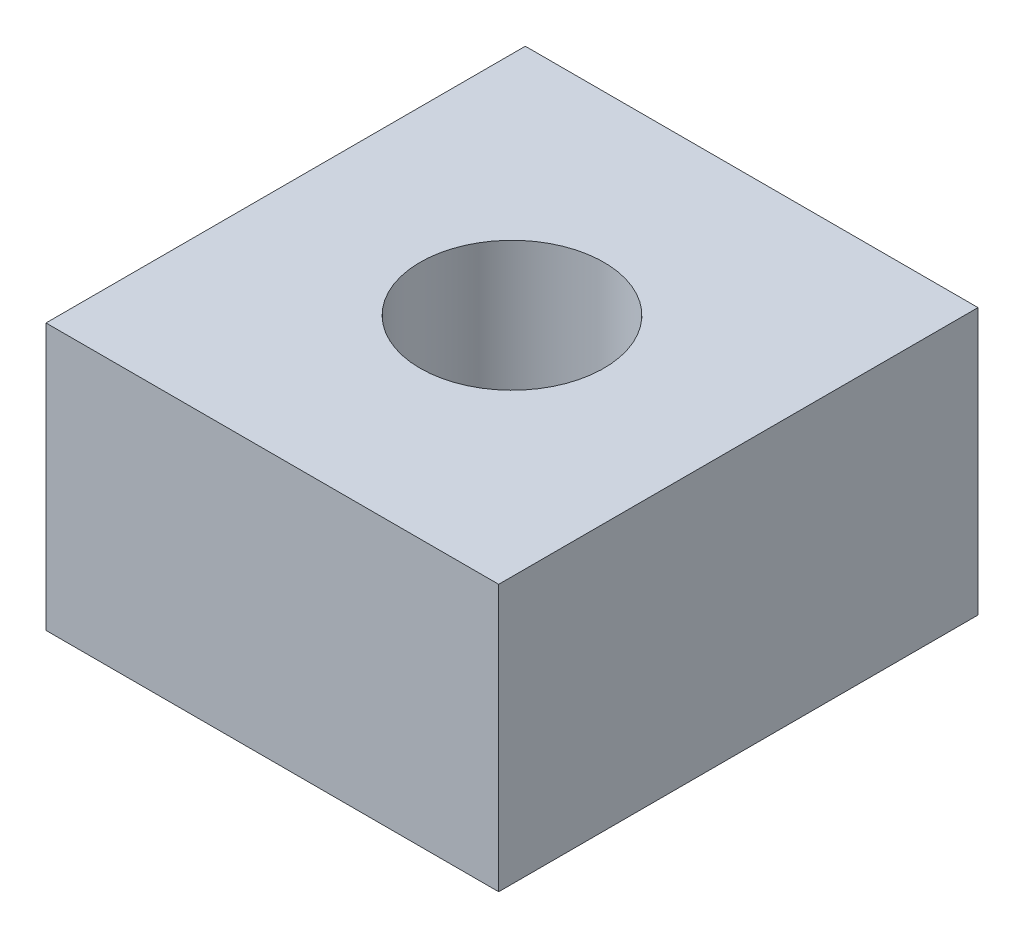
from build123d import *

# Parameters (mm, degrees)
SKETCH1_W           = 17
SKETCH1_H           = 18
BOSS_EXTRUDE1_DEPTH = 10
SKETCH2_R           = 3.45
CUT_EXTRUDE1_DEPTH  = 10


with BuildPart() as part:
    # Sketch1 → Boss-Extrude1 (new body)
    with BuildSketch(Plane(origin=(0, 0, 0), x_dir=(1, 0, 0), z_dir=(0, 1, 0))):
        with Locations((8.5, 9)):
            Rectangle(SKETCH1_W, SKETCH1_H)
    extrude(amount=BOSS_EXTRUDE1_DEPTH)

    # Sketch2 → Cut-Extrude1 (cut)
    with BuildSketch(Plane(origin=(0, 10, 0), x_dir=(1, 0, 0), z_dir=(0, 1, 0))):
        with Locations(Location((8.5, 9, 0), (0, 0, 270))):
            Circle(SKETCH2_R)
    extrude(amount=-CUT_EXTRUDE1_DEPTH, mode=Mode.SUBTRACT)


solid = part.part
